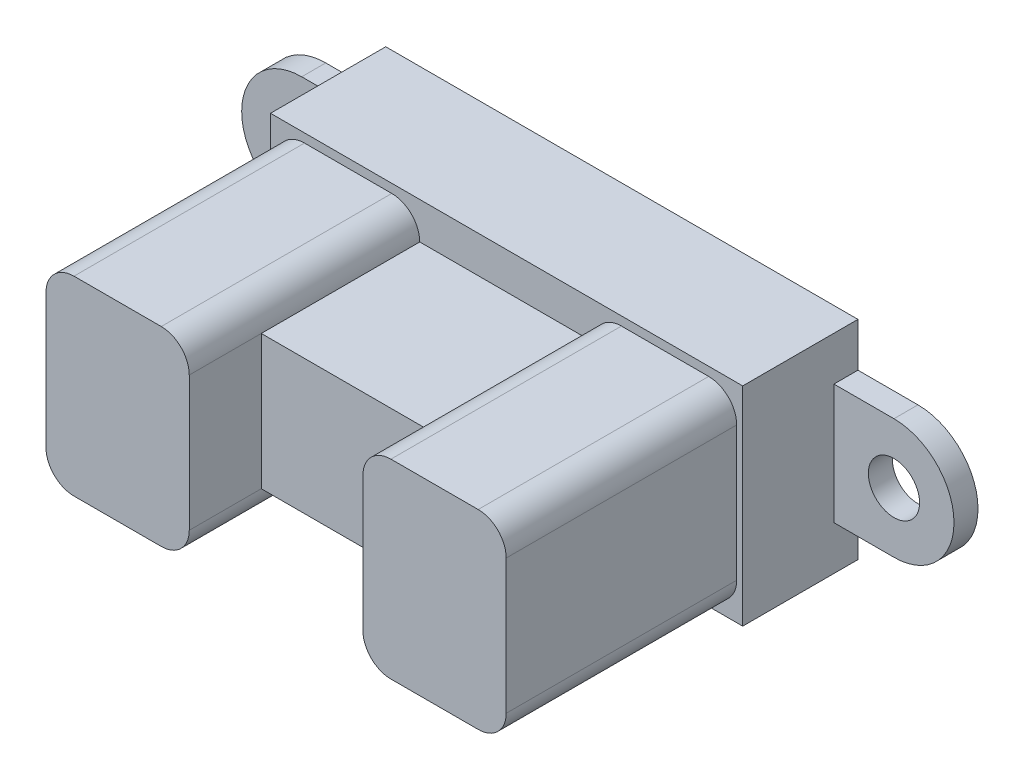
from build123d import *

# Parameters (mm, degrees)
SKETCH_1_W      = 29.5
SKETCH_1_H      = 13
EXTRUDE_1_DEPTH = 7.2
SKETCH_3_R      = 1.6
EXTRUDE_2_DEPTH = 1.5
EXTRUDE_3_DEPTH = 14.4
SKETCH_5_W      = 10.85
SKETCH_5_H      = 8.4
EXTRUDE_4_DEPTH = 9.9


with BuildPart() as part:
    # 스케치1 → 보스-돌출1 (new body)
    with BuildSketch(Plane.XY):
        Rectangle(SKETCH_1_W, SKETCH_1_H)
    extrude(amount=EXTRUDE_1_DEPTH)

    # 스케치3 → 보스-돌출2 (add)
    # profile 1 of 2: a face of its own
    with BuildSketch(Plane.XY):
        with BuildLine():
            Line((-18.5, 3.75), (-14.75, 3.75))
            Line((-14.75, 3.75), (-14.75, -3.75))
            Line((-14.75, -3.75), (-18.5, -3.75))
            ThreePointArc((-18.5, -3.75), (-22.25, 0), (-18.5, 3.75))
        make_face()
        with Locations((-18.5, 0)):
            Circle(SKETCH_3_R, mode=Mode.SUBTRACT)
    # profile 2 of 2: a face of its own
    with BuildSketch(Plane.XY):
        with BuildLine():
            Line((14.75, -3.75), (14.75, 3.75))
            Line((14.75, 3.75), (18.5, 3.75))
            ThreePointArc((18.5, 3.75), (22.25, 0), (18.5, -3.75))
            Line((18.5, -3.75), (14.75, -3.75))
        make_face()
        with Locations(Location((18.5, 0, 0), (0, 0, 180))):
            Circle(SKETCH_3_R, mode=Mode.SUBTRACT)
    extrude(amount=EXTRUDE_2_DEPTH)

    # 스케치4 → 보스-돌출3 (add)
    with BuildSketch(Plane.XY.offset(7.2)):
        with BuildLine():
            Line((-7.175, -5.95), (-12.625, -5.95))
            ThreePointArc((-12.625, -5.95), (-13.862436867, -5.437436867), (-14.375, -4.2))
            Line((-14.375, -4.2), (-14.375, 4.2))
            ThreePointArc((-14.375, 4.2), (-13.862436867, 5.437436867), (-12.625, 5.95))
            Line((-12.625, 5.95), (-7.175, 5.95))
            ThreePointArc((-7.175, 5.95), (-5.937563133, 5.437436867), (-5.425, 4.2))
            Line((-5.425, 4.2), (-5.425, -4.2))
            ThreePointArc((-5.425, -4.2), (-5.937563133, -5.437436867), (-7.175, -5.95))
        make_face()
        with BuildLine():
            Line((14.375, -4.2), (14.375, 4.2))
            ThreePointArc((14.375, 4.2), (13.862436867, 5.437436867), (12.625, 5.95))
            Line((12.625, 5.95), (7.175, 5.95))
            ThreePointArc((7.175, 5.95), (5.937563133, 5.437436867), (5.425, 4.2))
            Line((5.425, 4.2), (5.425, -4.2))
            ThreePointArc((5.425, -4.2), (5.937563133, -5.437436867), (7.175, -5.95))
            Line((7.175, -5.95), (12.625, -5.95))
            ThreePointArc((12.625, -5.95), (13.862436867, -5.437436867), (14.375, -4.2))
        make_face()
    extrude(amount=EXTRUDE_3_DEPTH)

    # 스케치5 → 보스-돌출4 (add)
    with BuildSketch(Plane.XY.offset(7.2)):
        Rectangle(SKETCH_5_W, SKETCH_5_H)
    extrude(amount=EXTRUDE_4_DEPTH)


solid = part.part
